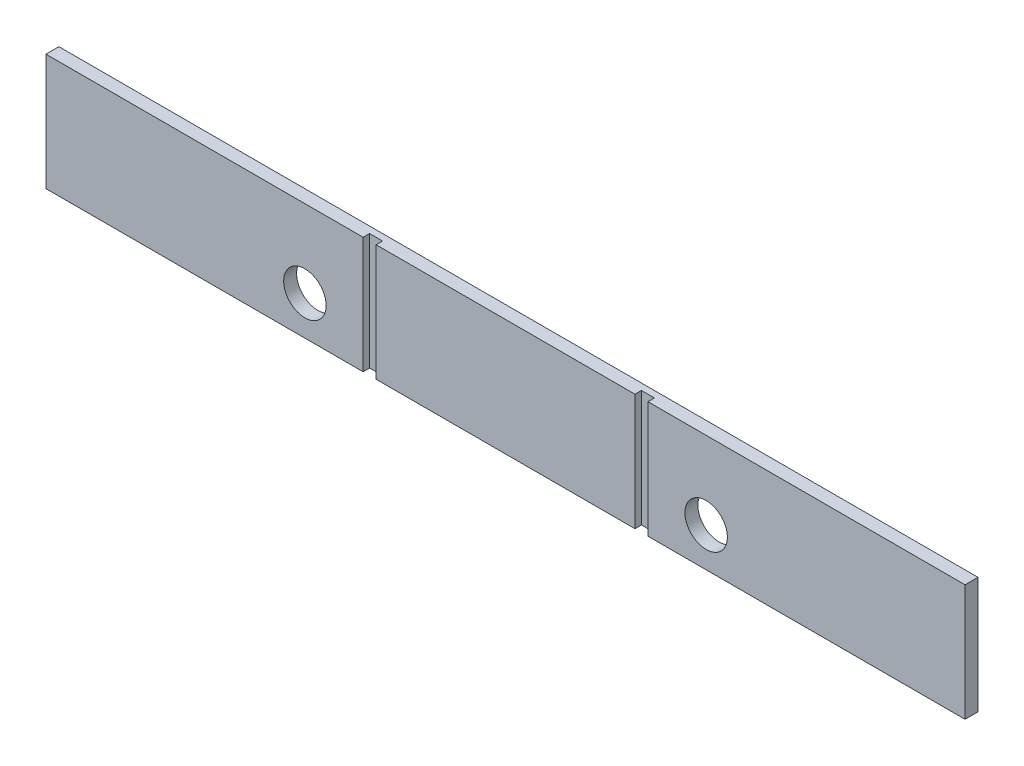
from build123d import *

# Parameters (mm, degrees)
SKETCH1_W           = 901.7
SKETCH1_H           = 114.3
BOSS_EXTRUDE1_DEPTH = 12.7
SKETCH2_W           = 12.7
SKETCH2_H           = 114.3
CUT_EXTRUDE1_DEPTH  = 6.35
CUT_EXTRUDE2_REACH  = 911.004
SKETCH3_R           = 20.828


with BuildPart() as part:
    # Sketch1 → Boss-Extrude1 (new body)
    with BuildSketch(Plane.XY):
        with Locations((450.85, 57.15)):
            Rectangle(SKETCH1_W, SKETCH1_H)
    extrude(amount=BOSS_EXTRUDE1_DEPTH)

    # Sketch2 → Cut-Extrude1 (cut)
    with BuildSketch(Plane.XY.offset(12.7)):
        with Locations((317.5, 57.15)):
            Rectangle(SKETCH2_W, SKETCH2_H)
        with Locations((584.2, 57.15)):
            Rectangle(SKETCH2_W, SKETCH2_H)
    extrude(amount=-CUT_EXTRUDE1_DEPTH, mode=Mode.SUBTRACT)

    # Sketch3 → Cut-Extrude2 (cut, up to next)
    with BuildSketch(Plane(origin=(0, 0, 0), x_dir=(-1, 0, 0), z_dir=(0, 0, -1)), mode=Mode.PRIVATE) as cut_extrude2_sk1:
        with Locations((-647.7, 38.1)):
            Circle(SKETCH3_R)
    cut_extrude2_tool1 = extrude(cut_extrude2_sk1.sketch, amount=-CUT_EXTRUDE2_REACH, mode=Mode.PRIVATE) & part.part
    # Sketch3 → Cut-Extrude2 (cut, up to next)
    with BuildSketch(Plane(origin=(0, 0, 0), x_dir=(-1, 0, 0), z_dir=(0, 0, -1)), mode=Mode.PRIVATE) as cut_extrude2_sk2:
        with Locations((-254, 38.1)):
            Circle(SKETCH3_R)
    cut_extrude2_tool2 = extrude(cut_extrude2_sk2.sketch, amount=-CUT_EXTRUDE2_REACH, mode=Mode.PRIVATE) & part.part
    add(cut_extrude2_tool1.solids().sort_by_distance((647.7, 38.1, 0))[0], mode=Mode.SUBTRACT)
    add(cut_extrude2_tool2.solids().sort_by_distance((254, 38.1, 0))[0], mode=Mode.SUBTRACT)


solid = part.part
